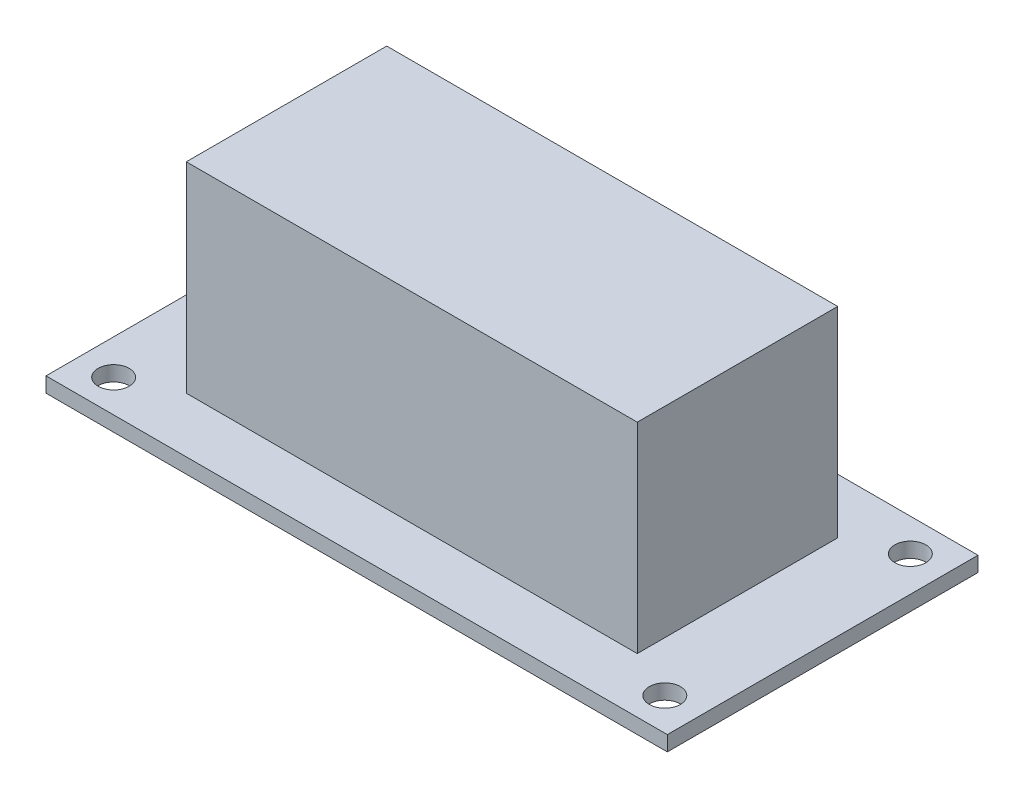
from build123d import *

# Parameters (mm, degrees)
SKETCH_1_W      = 62
SKETCH_1_H      = 31
SKETCH_1_R      = 1.55
EXTRUDE_1_DEPTH = 1.5
SKETCH_2_W      = 45
SKETCH_2_H      = 20
EXTRUDE_2_DEPTH = 20


with BuildPart() as part:
    # 草圖1 → 填料-伸長1 (new body)
    with BuildSketch(Plane(origin=(0, 0, 0), x_dir=(1, 0, 0), z_dir=(0, 1, 0))):
        Rectangle(SKETCH_1_W, SKETCH_1_H)
        with Locations(Location((-27.5, 12.25, 0), (0, 0, 270))):
            Circle(SKETCH_1_R, mode=Mode.SUBTRACT)
        with Locations(Location((27.5, 12.25, 0), (0, 0, 270))):
            Circle(SKETCH_1_R, mode=Mode.SUBTRACT)
        with Locations(Location((27.5, -12.25, 0), (0, 0, 270))):
            Circle(SKETCH_1_R, mode=Mode.SUBTRACT)
        with Locations(Location((-27.5, -12.25, 0), (0, 0, 270))):
            Circle(SKETCH_1_R, mode=Mode.SUBTRACT)
    extrude(amount=EXTRUDE_1_DEPTH)

    # 草圖2 → 填料-伸長2 (add)
    with BuildSketch(Plane(origin=(0, 1.5, 0), x_dir=(1, 0, 0), z_dir=(0, 1, 0))):
        Rectangle(SKETCH_2_W, SKETCH_2_H)
    extrude(amount=EXTRUDE_2_DEPTH)


solid = part.part
